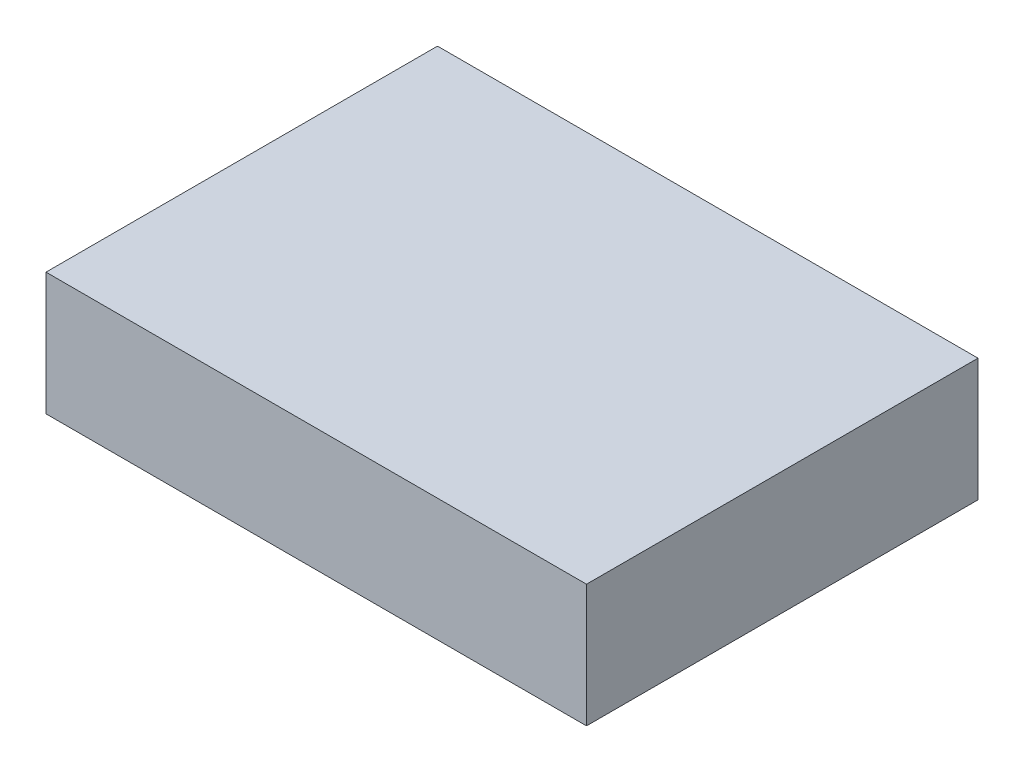
from build123d import *

# Parameters (mm, degrees)
SKETCH1_W           = 92.5
SKETCH1_H           = 67
BOSS_EXTRUDE1_DEPTH = 21


with BuildPart() as part:
    # Sketch1 → Boss-Extrude1 (new body)
    with BuildSketch(Plane(origin=(0, 0, 0), x_dir=(1, 0, 0), z_dir=(0, 1, 0))):
        with Locations((46.25, 33.5)):
            Rectangle(SKETCH1_W, SKETCH1_H)
    extrude(amount=BOSS_EXTRUDE1_DEPTH)


solid = part.part
